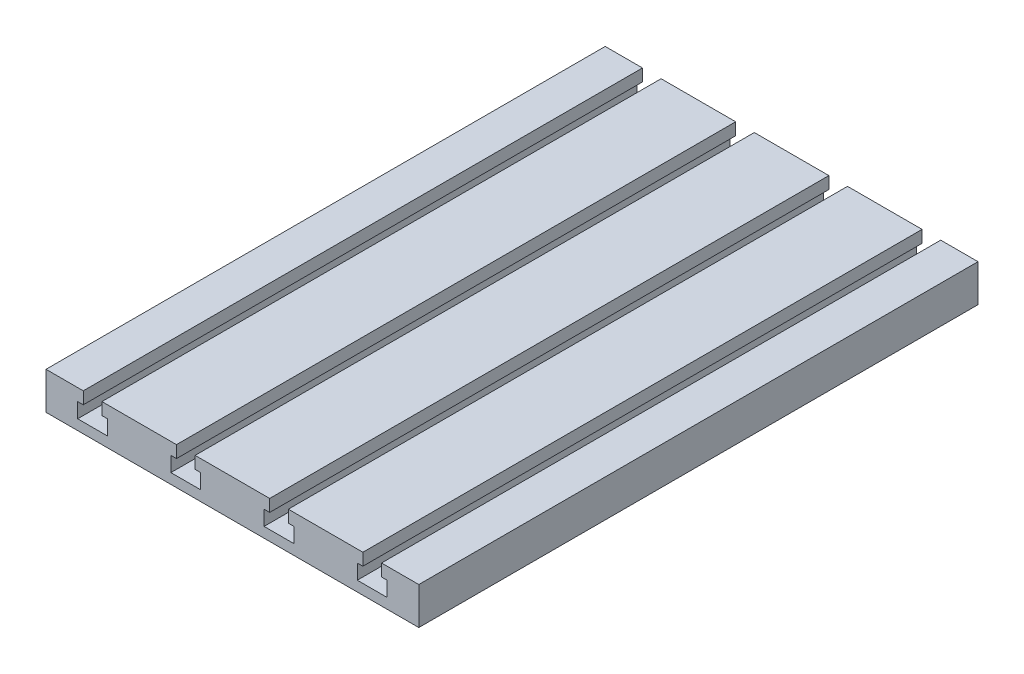
from build123d import *

# Parameters (mm, degrees)
AUFSATZ_LINEAR_AUSTRAGEN1_DEPTH = 300


with BuildPart() as part:
    # Skizze1 → Aufsatz-Linear austragen1 (new body)
    with BuildSketch(Plane.XY):
        Polygon((0, 0), (0, 20), (20, 20), (20, 13.5), (17, 13.5), (17, 5.5), (33, 5.5), (33, 13.5), (30, 13.5), (30, 20), (70, 20), (70, 13.5), (67, 13.5), (67, 5.5), (83, 5.5), (83, 13.5), (80, 13.5), (80, 20), (120, 20), (120, 13.5), (117, 13.5), (117, 5.5), (133, 5.5), (133, 13.5), (130, 13.5), (130, 20), (170, 20), (170, 13.5), (167, 13.5), (167, 5.5), (183, 5.5), (183, 13.5), (180, 13.5), (180, 20), (200, 20), (200, 0), align=None)
    extrude(amount=AUFSATZ_LINEAR_AUSTRAGEN1_DEPTH)


solid = part.part
